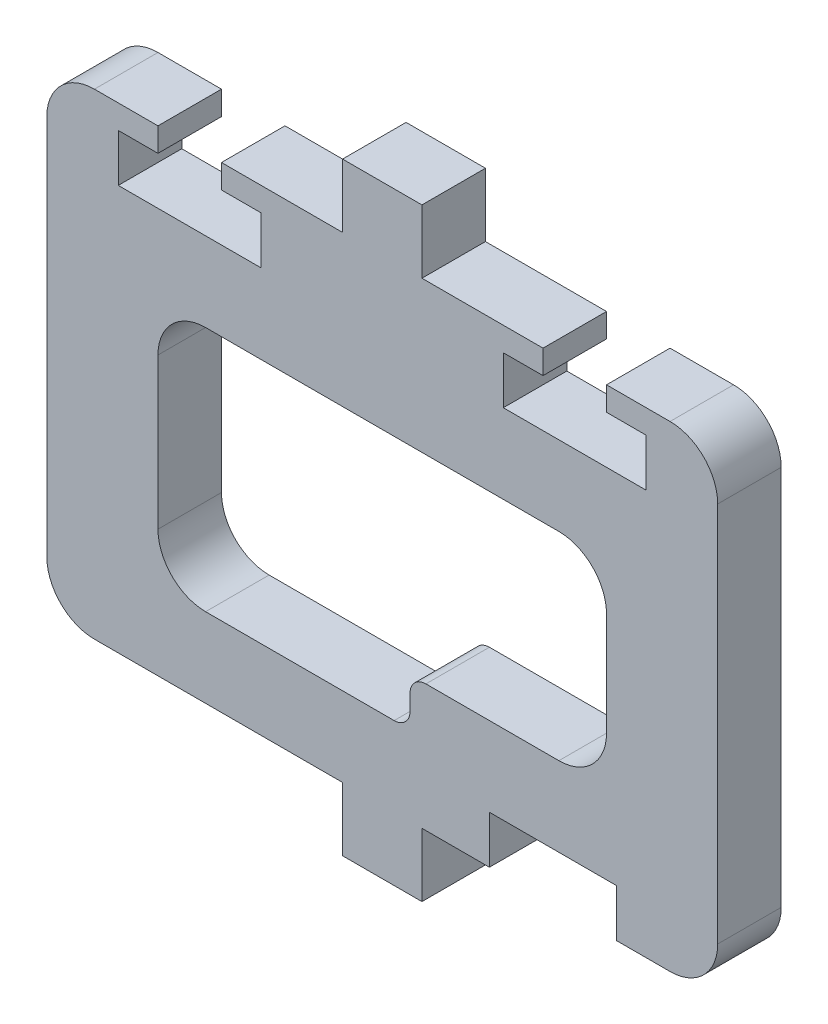
from build123d import *

# Parameters (mm, degrees)
SALIENTE_EXTRUIR1_DEPTH = 4
CORTAR_EXTRUIR1_DEPTH   = 4


with BuildPart() as part:
    # Croquis1 → Saliente-Extruir1 (new body)
    with BuildSketch(Plane.XY):
        with BuildLine():
            Line((-102.615102368, -94.221952824), (-98.365102368, -94.221952824))
            Line((-98.365102368, -94.221952824), (-98.365102368, -91.221952824))
            Line((-98.365102368, -91.221952824), (-90.365102368, -91.221952824))
            Line((-90.365102368, -91.221952824), (-90.365102368, -94.221952824))
            Line((-90.365102368, -94.221952824), (-86.990102368, -94.221952824))
            ThreePointArc((-86.990102368, -94.221952824), (-84.868782024, -93.343273168), (-83.990102368, -91.221952824))
            Line((-83.990102368, -91.221952824), (-83.990102368, -67.221952824))
            ThreePointArc((-83.990102368, -67.221952824), (-84.868782024, -65.10063248), (-86.990102368, -64.221952824))
            Line((-86.990102368, -64.221952824), (-90.990102368, -64.221952824))
            Line((-90.990102368, -64.221952824), (-90.990102368, -65.721952824))
            Line((-90.990102368, -65.721952824), (-88.490102368, -65.721952824))
            Line((-88.490102368, -65.721952824), (-88.490102368, -68.721952824))
            Line((-88.490102368, -68.721952824), (-97.490102368, -68.721952824))
            Line((-97.490102368, -68.721952824), (-97.490102368, -65.721952824))
            Line((-97.490102368, -65.721952824), (-94.990102368, -65.721952824))
            Line((-94.990102368, -65.721952824), (-94.990102368, -64.221952824))
            Line((-94.990102368, -64.221952824), (-102.615102368, -64.221952824))
            Line((-102.615102368, -64.221952824), (-102.615102368, -60.221952824))
            Line((-102.615102368, -60.221952824), (-105.115102368, -60.221952824))
            Line((-105.115102368, -60.221952824), (-107.615102368, -60.221952824))
            Line((-107.615102368, -60.221952824), (-107.615102368, -64.221952824))
            Line((-107.615102368, -64.221952824), (-115.240102368, -64.221952824))
            Line((-115.240102368, -64.221952824), (-115.240102368, -65.721952824))
            Line((-115.240102368, -65.721952824), (-112.740102368, -65.721952824))
            Line((-112.740102368, -65.721952824), (-112.740102368, -68.721952824))
            Line((-112.740102368, -68.721952824), (-121.740102368, -68.721952824))
            Line((-121.740102368, -68.721952824), (-121.740102368, -65.721952824))
            Line((-121.740102368, -65.721952824), (-119.240102368, -65.721952824))
            Line((-119.240102368, -65.721952824), (-119.240102368, -64.221952824))
            Line((-119.240102368, -64.221952824), (-123.240102368, -64.221952824))
            ThreePointArc((-123.240102368, -64.221952824), (-125.361422711, -65.10063248), (-126.240102368, -67.221952824))
            Line((-126.240102368, -67.221952824), (-126.240102368, -91.221952824))
            ThreePointArc((-126.240102368, -91.221952824), (-125.361422711, -93.343273168), (-123.240102368, -94.221952824))
            Line((-123.240102368, -94.221952824), (-107.615102368, -94.221952824))
            Line((-107.615102368, -94.221952824), (-107.615102368, -98.221952824))
            Line((-107.615102368, -98.221952824), (-105.115102368, -98.221952824))
            Line((-105.115102368, -98.221952824), (-102.615102368, -98.221952824))
            Line((-102.615102368, -98.221952824), (-102.615102368, -94.221952824))
        make_face()
    extrude(amount=SALIENTE_EXTRUIR1_DEPTH)

    # Croquis2 → Cortar-Extruir1 (cut)
    with BuildSketch(Plane.XY.offset(4)):
        with BuildLine():
            Line((-102.365102368, -86.221952824), (-93.990102368, -86.221952824))
            ThreePointArc((-93.990102368, -86.221952824), (-91.868782024, -85.343273168), (-90.990102368, -83.221952824))
            Line((-90.990102368, -83.221952824), (-90.990102368, -76.721952824))
            ThreePointArc((-90.990102368, -76.721952824), (-91.868782024, -74.60063248), (-93.990102368, -73.721952824))
            Line((-93.990102368, -73.721952824), (-116.240102368, -73.721952824))
            ThreePointArc((-116.240102368, -73.721952824), (-118.361422711, -74.60063248), (-119.240102368, -76.721952824))
            Line((-119.240102368, -76.721952824), (-119.240102368, -86.221952824))
            ThreePointArc((-119.240102368, -86.221952824), (-118.361422711, -88.343273168), (-116.240102368, -89.221952824))
            Line((-116.240102368, -89.221952824), (-104.365102368, -89.221952824))
            ThreePointArc((-104.365102368, -89.221952824), (-103.657995587, -88.929059605), (-103.365102368, -88.221952824))
            Line((-103.365102368, -88.221952824), (-103.365102368, -87.221952824))
            ThreePointArc((-103.365102368, -87.221952824), (-103.072209149, -86.514846043), (-102.365102368, -86.221952824))
        make_face()
    extrude(amount=-CORTAR_EXTRUIR1_DEPTH, mode=Mode.SUBTRACT)


solid = part.part
